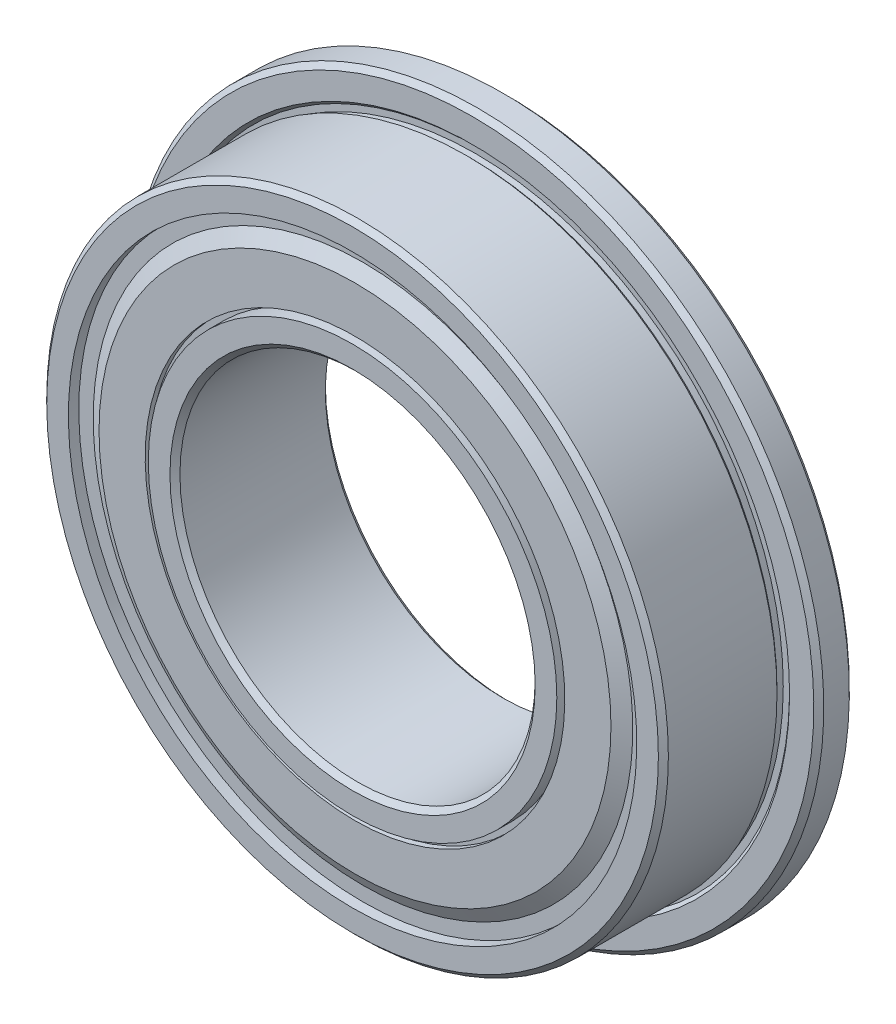
from build123d import *

# Parameters (mm, degrees)
FILLET1_SIZE      = 0.1125
FILLET2_SIZE      = 0.1125
CIRPATTERN3_COUNT = 19
SKETCH8_W         = 0.36
SKETCH8_H         = 0.3


with BuildPart() as part:
    # Sketch2 → Revolve1 (revolve)
    with BuildSketch(Plane(origin=(0, 0, 0), x_dir=(0, 0, -1), z_dir=(1, 0, 0))):
        with BuildLine():
            Line((1.75, 7.8), (0.95, 7.8))
            Line((0.95, 7.8), (0.95, 7.141421356))
            Line((0.95, 7.141421356), (1.020710678, 7.070710678))
            Line((1.020710678, 7.070710678), (1.020710678, 6.929289322))
            Line((1.020710678, 6.929289322), (0.879289322, 6.929289322))
            Line((0.879289322, 6.929289322), (0.808578644, 7))
            Line((0.808578644, 7), (-1.75, 7))
            Line((-1.75, 7), (-1.75, 6.1))
            Line((-1.75, 6.1), (-0.45, 6.1))
            ThreePointArc((-0.45, 6.1), (0, 6.25), (0.45, 6.1))
            Line((0.45, 6.1), (1.75, 6.1))
            Line((1.75, 6.1), (1.75, 7.8))
        make_face()
        with BuildLine():
            Line((1.75, 4), (-1.75, 4))
            Line((-1.75, 4), (-1.75, 4.9))
            Line((-1.75, 4.9), (-0.45, 4.9))
            ThreePointArc((-0.45, 4.9), (0, 4.75), (0.45, 4.9))
            Line((0.45, 4.9), (1.75, 4.9))
            Line((1.75, 4.9), (1.75, 4))
        make_face()
    revolve(axis=Axis((0, 0, 0), (0, 0, -1)))

    # Fillet1
    fillet1_edges = [part.edges().sort_by_distance(p)[0] for p in [
        (0, -7.8, -1.75),
        (0, -7.8, -0.95),
        (0, -7, 1.75),
    ]]
    chamfer(fillet1_edges, length=FILLET1_SIZE)

    # Fillet2
    fillet2_edges = [part.edges().sort_by_distance(p)[0] for p in [
        (0, -4, -1.75),
        (0, -4, 1.75),
    ]]
    chamfer(fillet2_edges, length=FILLET2_SIZE)

    # Sketch8 → Cut-Revolve1 (revolve, cut)
    with BuildSketch(Plane(origin=(0, 0, 0), x_dir=(0, 0, -1), z_dir=(1, 0, 0))):
        with Locations((-1.57, 6.25)):
            Rectangle(SKETCH8_W, SKETCH8_H)
        with Locations((1.57, 6.25)):
            Rectangle(SKETCH8_W, SKETCH8_H)
        with Locations((1.57, 4.75)):
            Rectangle(SKETCH8_W, SKETCH8_H)
        with Locations((-1.57, 4.75)):
            Rectangle(SKETCH8_W, SKETCH8_H)
    revolve(axis=Axis((0, 0, 0), (0, 0, -1)), mode=Mode.SUBTRACT)


with BuildPart() as body_2:
    # Sketch7 → Revolve3 (revolve)
    with BuildSketch(Plane.XY):
        with BuildLine():
            Line((0, 6.25), (0, 4.75))
            ThreePointArc((0, 4.75), (-0.75, 5.5), (0, 6.25))
        make_face()
    revolve(axis=Axis((0, 6.25, 0), (0, -1, 0)))


with BuildPart() as cirpattern3_1:
    # CirPattern3: pattern copy
    add(body_2.part.rotate(Axis((0, 0, 0), (0, 0, -1)), 1 * 360 / CIRPATTERN3_COUNT))


with BuildPart() as cirpattern3_2:
    # CirPattern3: pattern copy
    add(body_2.part.rotate(Axis((0, 0, 0), (0, 0, -1)), 2 * 360 / CIRPATTERN3_COUNT))


with BuildPart() as cirpattern3_3:
    # CirPattern3: pattern copy
    add(body_2.part.rotate(Axis((0, 0, 0), (0, 0, -1)), 3 * 360 / CIRPATTERN3_COUNT))


with BuildPart() as cirpattern3_4:
    # CirPattern3: pattern copy
    add(body_2.part.rotate(Axis((0, 0, 0), (0, 0, -1)), 4 * 360 / CIRPATTERN3_COUNT))


with BuildPart() as cirpattern3_5:
    # CirPattern3: pattern copy
    add(body_2.part.rotate(Axis((0, 0, 0), (0, 0, -1)), 5 * 360 / CIRPATTERN3_COUNT))


with BuildPart() as cirpattern3_6:
    # CirPattern3: pattern copy
    add(body_2.part.rotate(Axis((0, 0, 0), (0, 0, -1)), 6 * 360 / CIRPATTERN3_COUNT))


with BuildPart() as cirpattern3_7:
    # CirPattern3: pattern copy
    add(body_2.part.rotate(Axis((0, 0, 0), (0, 0, -1)), 7 * 360 / CIRPATTERN3_COUNT))


with BuildPart() as cirpattern3_8:
    # CirPattern3: pattern copy
    add(body_2.part.rotate(Axis((0, 0, 0), (0, 0, -1)), 8 * 360 / CIRPATTERN3_COUNT))


with BuildPart() as cirpattern3_9:
    # CirPattern3: pattern copy
    add(body_2.part.rotate(Axis((0, 0, 0), (0, 0, -1)), 9 * 360 / CIRPATTERN3_COUNT))


with BuildPart() as cirpattern3_10:
    # CirPattern3: pattern copy
    add(body_2.part.rotate(Axis((0, 0, 0), (0, 0, -1)), 10 * 360 / CIRPATTERN3_COUNT))


with BuildPart() as cirpattern3_11:
    # CirPattern3: pattern copy
    add(body_2.part.rotate(Axis((0, 0, 0), (0, 0, -1)), 11 * 360 / CIRPATTERN3_COUNT))


with BuildPart() as cirpattern3_12:
    # CirPattern3: pattern copy
    add(body_2.part.rotate(Axis((0, 0, 0), (0, 0, -1)), 12 * 360 / CIRPATTERN3_COUNT))


with BuildPart() as cirpattern3_13:
    # CirPattern3: pattern copy
    add(body_2.part.rotate(Axis((0, 0, 0), (0, 0, -1)), 13 * 360 / CIRPATTERN3_COUNT))


with BuildPart() as cirpattern3_14:
    # CirPattern3: pattern copy
    add(body_2.part.rotate(Axis((0, 0, 0), (0, 0, -1)), 14 * 360 / CIRPATTERN3_COUNT))


with BuildPart() as cirpattern3_15:
    # CirPattern3: pattern copy
    add(body_2.part.rotate(Axis((0, 0, 0), (0, 0, -1)), 15 * 360 / CIRPATTERN3_COUNT))


with BuildPart() as cirpattern3_16:
    # CirPattern3: pattern copy
    add(body_2.part.rotate(Axis((0, 0, 0), (0, 0, -1)), 16 * 360 / CIRPATTERN3_COUNT))


with BuildPart() as cirpattern3_17:
    # CirPattern3: pattern copy
    add(body_2.part.rotate(Axis((0, 0, 0), (0, 0, -1)), 17 * 360 / CIRPATTERN3_COUNT))


with BuildPart() as cirpattern3_18:
    # CirPattern3: pattern copy
    add(body_2.part.rotate(Axis((0, 0, 0), (0, 0, -1)), 18 * 360 / CIRPATTERN3_COUNT))


with BuildPart() as body_21:
    # Sketch9 → Revolve4 (revolve)
    with BuildSketch(Plane(origin=(0, 0, 0), x_dir=(0, 0, -1), z_dir=(1, 0, 0))):
        Polygon((-1.39, 6.4), (-1.39, 6.042857143), (-1.57, 5.731087997), (-1.57, 4.725), (-1.695, 4.725), (-1.695, 5.764581647), (-1.515, 6.076350792), (-1.515, 6.4), align=None)
        Polygon((1.39, 6.4), (1.39, 6.042857143), (1.57, 5.731087997), (1.57, 4.725), (1.695, 4.725), (1.695, 5.764581647), (1.515, 6.076350792), (1.515, 6.4), align=None)
    revolve(axis=Axis((0, 0, 0), (0, 0, -1)))


solid = Compound([part.part, body_2.part, cirpattern3_1.part, cirpattern3_2.part, cirpattern3_3.part, cirpattern3_4.part, cirpattern3_5.part, cirpattern3_6.part, cirpattern3_7.part, cirpattern3_8.part, cirpattern3_9.part, cirpattern3_10.part, cirpattern3_11.part, cirpattern3_12.part, cirpattern3_13.part, cirpattern3_14.part, cirpattern3_15.part, cirpattern3_16.part, cirpattern3_17.part, cirpattern3_18.part, body_21.part])
